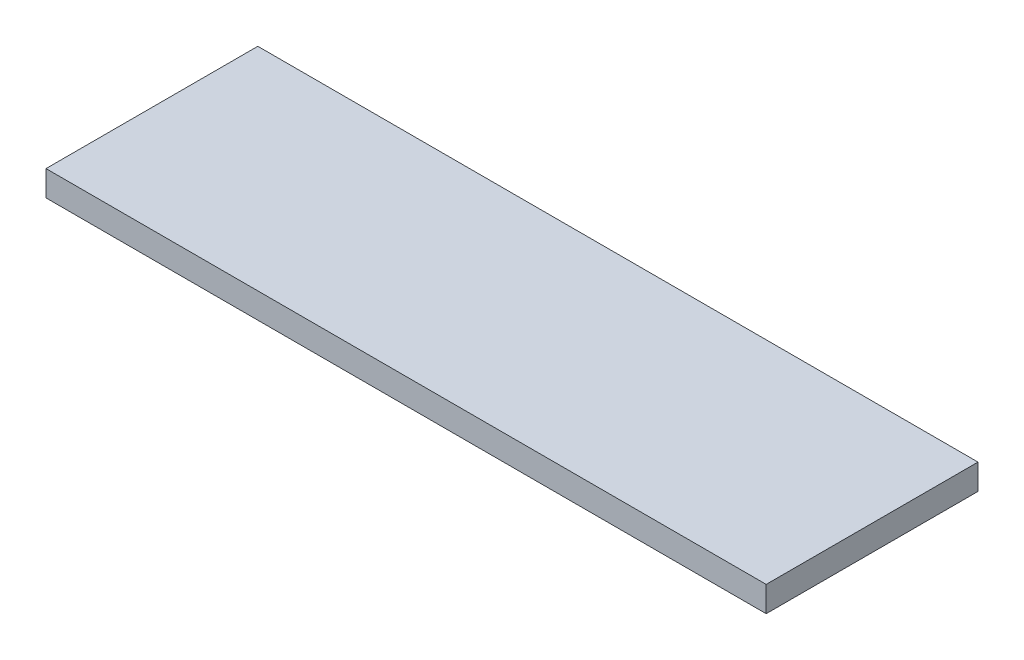
from build123d import *

# Parameters (mm, degrees)
SKETCH1_W           = 85
SKETCH1_H           = 3
BOSS_EXTRUDE1_DEPTH = 25


with BuildPart() as part:
    # Sketch1 → Boss-Extrude1 (new body)
    with BuildSketch(Plane.XY):
        with Locations((42.5, 1.5)):
            Rectangle(SKETCH1_W, SKETCH1_H)
    extrude(amount=BOSS_EXTRUDE1_DEPTH)


solid = part.part
